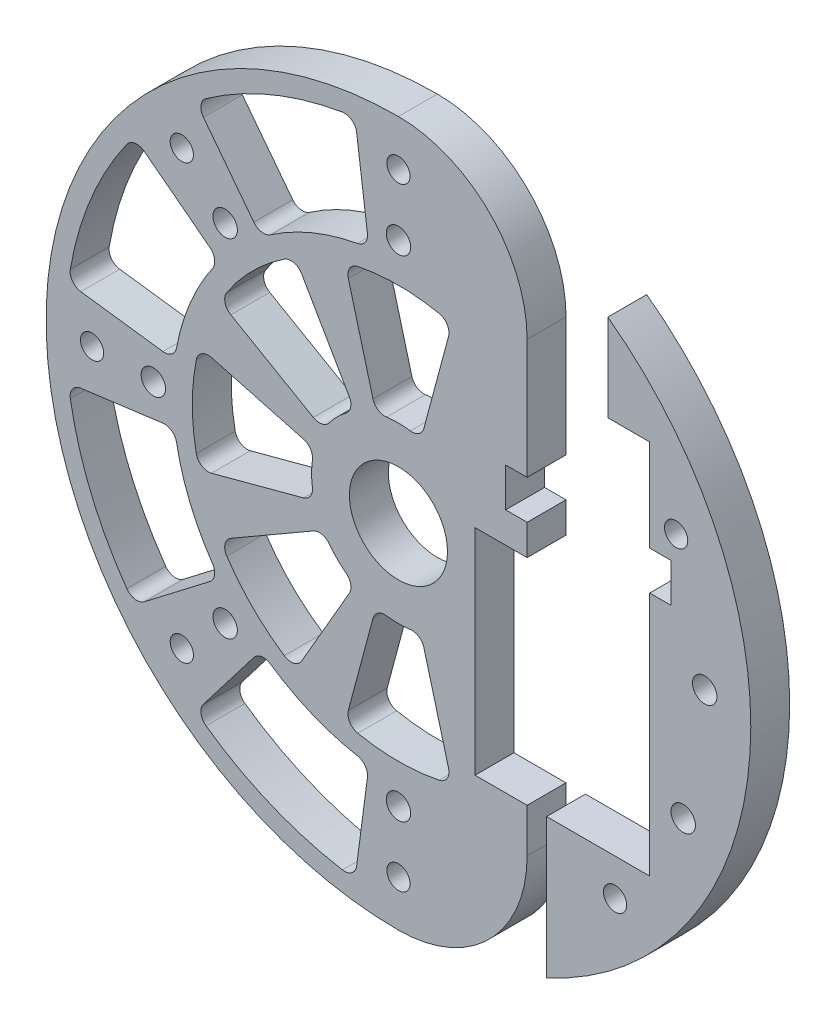
from build123d import *

# Parameters (mm, degrees)
SKETCH1_R                = 57.5
SKETCH1_R_2              = 1.89865
SKETCH1_R_3              = 1.9939
SKETCH1_R_4              = 8
BOSS_EXTRUDE1_DEPTH      = 6.35
CUT_EXTRUDE1_DEPTH       = 82.564836173
SKETCH3_W                = 6.35
SKETCH3_H                = 80
CUT_EXTRUDE3_DEPTH       = 82.564836173
CUT_EXTRUDE4_DEPTH       = 82.564836173
CUT_EXTRUDE5_DEPTH       = 82.564836173
CUT_EXTRUDE6_DEPTH       = 82.564836173
FILLET1_R                = 2
CIRPATTERN1_COUNT        = 8
FILLET1_OF_CIRPATTERN1_R = 2
CUT_EXTRUDE7_DEPTH       = 10
FILLET2_R                = 2
CIRPATTERN2_COUNT        = 8
FILLET2_OF_CIRPATTERN2_R = 2


with BuildPart() as part:
    # Sketch1 → Boss-Extrude1 (new body)
    with BuildSketch(Plane.XY):
        Circle(SKETCH1_R)
        with Locations((45.315389352, 21.130913087)):
            Circle(SKETCH1_R_2, mode=Mode.SUBTRACT)
        with Locations((46.467376211, -18.460307366)):
            Circle(SKETCH1_R_3, mode=Mode.SUBTRACT)
        Circle(SKETCH1_R_4, mode=Mode.SUBTRACT)
        with Locations((49.978847504, 1.454235937)):
            Circle(SKETCH1_R_3, mode=Mode.SUBTRACT)
        with Locations((0, -40)):
            Circle(SKETCH1_R_3, mode=Mode.SUBTRACT)
        with Locations((0, -50)):
            Circle(SKETCH1_R_2, mode=Mode.SUBTRACT)
        with Locations((-28.284271247, -28.284271247)):
            Circle(SKETCH1_R_3, mode=Mode.SUBTRACT)
        with Locations((-35.355339059, -35.355339059)):
            Circle(SKETCH1_R_2, mode=Mode.SUBTRACT)
        with Locations((-40, 0)):
            Circle(SKETCH1_R_3, mode=Mode.SUBTRACT)
        with Locations((-50, 0)):
            Circle(SKETCH1_R_2, mode=Mode.SUBTRACT)
        with Locations((-28.284271247, 28.284271247)):
            Circle(SKETCH1_R_3, mode=Mode.SUBTRACT)
        with Locations((-35.355339059, 35.355339059)):
            Circle(SKETCH1_R_2, mode=Mode.SUBTRACT)
        with Locations((0, 40)):
            Circle(SKETCH1_R_3, mode=Mode.SUBTRACT)
        with Locations((0, 50)):
            Circle(SKETCH1_R_2, mode=Mode.SUBTRACT)
        with Locations((35.355339059, -35.355339059)):
            Circle(SKETCH1_R_2, mode=Mode.SUBTRACT)
    extrude(amount=BOSS_EXTRUDE1_DEPTH)

    # Sketch2 → Cut-Extrude1 (cut, through all)
    with BuildSketch(Plane.XY):
        Polygon((12.5, -29.35), (41, -29.35), (41, 10.65), (44.5, 10.65), (44.5, 17), (41, 17), (41, 32), (21, 32), (21, 17), (17.5, 17), (17.5, 10.65), (21, 10.65), (21, 5.65), (12.5, 5.65), align=None)
    extrude(amount=CUT_EXTRUDE1_DEPTH, mode=Mode.SUBTRACT)

    # Sketch3 → Cut-Extrude3 (cut, through all)
    with BuildSketch(Plane.XY.offset(6.35)):
        with Locations((31, 32)):
            Rectangle(SKETCH3_W, SKETCH3_H)
    extrude(amount=-CUT_EXTRUDE3_DEPTH, mode=Mode.SUBTRACT)

    # Sketch4 → Cut-Extrude4 (cut, through all)
    with BuildSketch(Plane.XY.offset(6.35)):
        with BuildLine():
            Line((21, -36.5), (21, -16.443021443))
            Line((21, -16.443021443), (24.175, -16.470277755))
            Line((24.175, -16.470277755), (24.175, -57.5))
            Line((24.175, -57.5), (0, -57.5))
            ThreePointArc((0, -57.5), (14.849242405, -51.349242405), (21, -36.5))
        make_face()
        with BuildLine():
            Line((0, 57.5), (24.175, 57.5))
            Line((24.175, 57.5), (24.175, 16.470277755))
            Line((24.175, 16.470277755), (21, 16.443021443))
            Line((21, 16.443021443), (21, 36.5))
            ThreePointArc((21, 36.5), (14.849242405, 51.349242405), (0, 57.5))
        make_face()
    extrude(amount=-CUT_EXTRUDE4_DEPTH, mode=Mode.SUBTRACT)


with BuildPart() as cut_extrude4_piece_1:
    # of the separate pieces the step leaves, piece 1, a body of its own (cut_extrude4_pieces)
    add(part.part.solids().sort_by_distance((0, 57.5, 0))[0])

    # Sketch6 → Cut-Extrude6 (cut, through all)
    with BuildSketch(Plane.XY.offset(6.35)):
        with BuildLine():
            Line((-13.691998588, 3.668759964), (-32.503404055, 8.709260868))
            ThreePointArc((-32.503404055, 8.709260868), (-33.65, 0), (-32.503404055, -8.709260868))
            Line((-32.503404055, -8.709260868), (-13.691998588, -3.668759964))
            ThreePointArc((-13.691998588, -3.668759964), (-14.175, 0), (-13.691998588, 3.668759964))
        make_face()
    cut_extrude6 = extrude(amount=-CUT_EXTRUDE6_DEPTH, mode=Mode.SUBTRACT)

    # Fillet1
    fillet1_edges = [cut_extrude4_piece_1.edges().sort_by_distance(p)[0] for p in [
        (-13.691998588, 3.668759964, 3.175),
        (-13.691998588, -3.668759964, 3.175),
        (-32.503404055, -8.709260868, 3.175),
        (-32.503404055, 8.709260868, 3.175),
    ]]
    fillet(fillet1_edges, radius=FILLET1_R)

    # CirPattern1: Cut-Extrude6 ×8 about axis, 3 skipped
    cirpattern1_axis = Axis((0, 0, 0), (0, 0, -1))
    add([cut_extrude6.rotate(cirpattern1_axis, i * 360 / CIRPATTERN1_COUNT) for i in range(1, CIRPATTERN1_COUNT) if i not in (3, 4, 5)], mode=Mode.SUBTRACT)

    # Fillet1 of CirPattern1
    fillet1_of_cirpattern1_edges = [cut_extrude4_piece_1.edges().sort_by_distance(p)[0] for p in [
        (-7.0875, 12.275910099, 3.175),
        (-12.275910099, 7.0875, 3.175),
        (-29.141754837, 16.825, 3.175),
        (-16.825, 29.141754837, 3.175),
        (3.668759964, 13.691998588, 3.175),
        (-3.668759964, 13.691998588, 3.175),
        (-8.709260868, 32.503404055, 3.175),
        (8.709260868, 32.503404055, 3.175),
        (-3.668759964, -13.691998588, 3.175),
        (3.668759964, -13.691998588, 3.175),
        (8.709260868, -32.503404055, 3.175),
        (-8.709260868, -32.503404055, 3.175),
        (-12.275910099, -7.0875, 3.175),
        (-7.0875, -12.275910099, 3.175),
        (-16.825, -29.141754837, 3.175),
        (-29.141754837, -16.825, 3.175),
    ]]
    fillet(fillet1_of_cirpattern1_edges, radius=FILLET1_OF_CIRPATTERN1_R)

    # Sketch7 → Cut-Extrude7 (cut)
    with BuildSketch(Plane.XY.offset(6.35)):
        with BuildLine():
            Line((-43.098920211, 33.070964631), (-29.215236756, 22.417639623))
            ThreePointArc((-29.215236756, 22.417639623), (-34.021863785, 14.092317397), (-36.50995702, 4.806627029))
            Line((-36.50995702, 4.806627029), (-53.860242094, 7.090835392))
            ThreePointArc((-53.860242094, 7.090835392), (-50.189755604, 20.789277463), (-43.098920211, 33.070964631))
        make_face()
    cut_extrude7 = extrude(amount=-CUT_EXTRUDE7_DEPTH, mode=Mode.SUBTRACT)

    # Fillet2
    fillet2_edges = [cut_extrude4_piece_1.edges().sort_by_distance(p)[0] for p in [
        (-29.215236756, 22.417639623, 3.175),
        (-36.50995702, 4.806627029, 3.175),
        (-53.860242094, 7.090835392, 3.175),
        (-43.098920211, 33.070964631, 3.175),
    ]]
    fillet(fillet2_edges, radius=FILLET2_R)

    # CirPattern2: Cut-Extrude7 ×8 about axis, 4 skipped
    cirpattern2_axis = Axis((0, 0, 0), (0, 0, -1))
    add([cut_extrude7.rotate(cirpattern2_axis, i * 360 / CIRPATTERN2_COUNT) for i in range(1, CIRPATTERN2_COUNT) if i not in (2, 3, 4, 5)], mode=Mode.SUBTRACT)

    # Fillet2 of CirPattern2
    fillet2_of_cirpattern2_edges = [cut_extrude4_piece_1.edges().sort_by_distance(p)[0] for p in [
        (-4.806627029, 36.50995702, 3.175),
        (-22.417639623, 29.215236756, 3.175),
        (-33.070964631, 43.098920211, 3.175),
        (-7.090835392, 53.860242094, 3.175),
        (-22.417639623, -29.215236756, 3.175),
        (-4.806627029, -36.50995702, 3.175),
        (-7.090835392, -53.860242094, 3.175),
        (-33.070964631, -43.098920211, 3.175),
        (-36.50995702, -4.806627029, 3.175),
        (-29.215236756, -22.417639623, 3.175),
        (-43.098920211, -33.070964631, 3.175),
        (-53.860242094, -7.090835392, 3.175),
    ]]
    fillet(fillet2_of_cirpattern2_edges, radius=FILLET2_OF_CIRPATTERN2_R)


with BuildPart() as cut_extrude4_piece_2:
    # of the separate pieces the step leaves, piece 2, a body of its own (cut_extrude4_pieces)
    add(part.part.solids().sort_by_distance((24.175, -52.171058787, 0))[0])


with BuildPart() as cut_extrude4_piece_3:
    # of the separate pieces the step leaves, piece 3, a body of its own (cut_extrude4_pieces)
    add(part.part.solids().sort_by_distance((24.175, 52.171058787, 6.35))[0])

    # Sketch5 → Cut-Extrude5 (cut, through all)
    with BuildSketch(Plane.XY.offset(6.35)):
        with BuildLine():
            Line((24.175, 52.171058787), (24.175, 32))
            Line((24.175, 32), (27.825, 32))
            Line((27.825, 32), (27.825, 50.319175023))
            ThreePointArc((27.825, 50.319175023), (26.016482629, 51.277603607), (24.175, 52.171058787))
        make_face()
    extrude(amount=-CUT_EXTRUDE5_DEPTH, mode=Mode.SUBTRACT)


solid = Compound([cut_extrude4_piece_1.part, cut_extrude4_piece_2.part])
